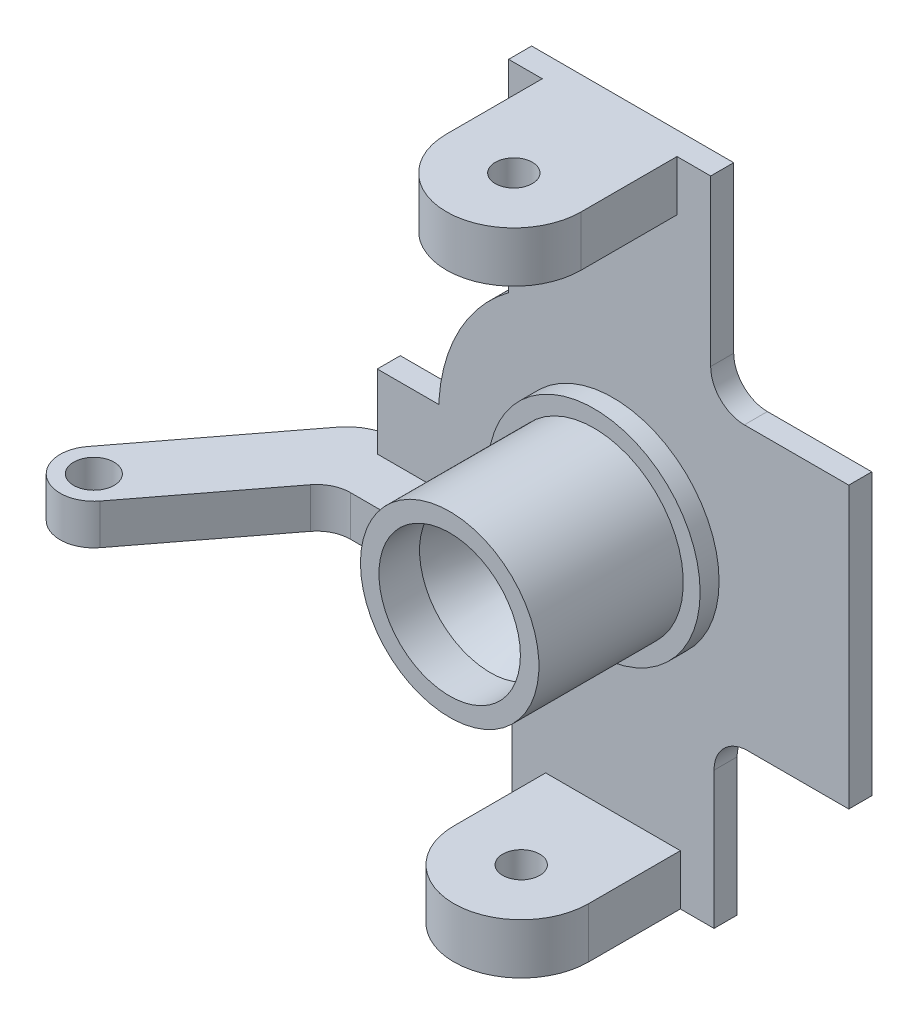
from build123d import *

# Parameters (mm, degrees)
EXTRUDE_1_DEPTH     = 6.84
EXTRUDE_2_DEPTH     = 12
SKETCH_3_R          = 26.5
EXTRUDE_3_DEPTH     = 48.5
SKETCH_4_R          = 31.5
EXTRUDE_4_DEPTH     = 5.63
SKETCH_5_R          = 21
CUT_EXTRUDE_1_DEPTH = 9.13
SKETCH_6_R          = 21
CUT_EXTRUDE_2_DEPTH = 2.92
SKETCH_7_R          = 16
SKETCH_9_R          = 21
SKETCH_8_R          = 16
SKETCH_10_R         = 17
CUT_EXTRUDE_3_DEPTH = 13.29
SKETCH_11_R         = 6
CUT_EXTRUDE_4_DEPTH = 42.92
EXTRUDE_5_DEPTH     = 15
SKETCH_13_R         = 5.5
CUT_EXTRUDE_5_DEPTH = 15
EXTRUDE_6_DEPTH     = 15
SKETCH_16_R         = 5.5
CUT_EXTRUDE_6_DEPTH = 15


with BuildPart() as part:
    # 스케치1 → 보스-돌출1 (new body)
    with BuildSketch(Plane.XY):
        with BuildLine():
            Line((-34.998826986, -181.181097978), (-34.998826986, -140.481097978))
            ThreePointArc((-34.998826986, -140.481097978), (-32.069894798, -133.410030166), (-24.998826986, -130.481097978))
            Line((-24.998826986, -130.481097978), (5.001173014, -130.481097978))
            Line((5.001173014, -130.481097978), (5.001173014, -47.181097978))
            Line((5.001173014, -47.181097978), (-25.998826986, -47.181097978))
            ThreePointArc((-25.998826986, -47.181097978), (-33.069894798, -44.25216579), (-35.998826986, -37.181097978))
            Line((-35.998826986, -37.181097978), (-35.998826986, 11.818902022))
            Line((-35.998826986, 11.818902022), (-95.998826986, 11.818902022))
            Line((-95.998826986, 11.818902022), (-95.998826986, -48.181097978))
            ThreePointArc((-95.998826986, -48.181097978), (-110.502915378, -64.929776001), (-116.68226469, -86.206581157))
            Line((-116.68226469, -86.206581157), (-116.68226469, -87.311097978))
            Line((-116.68226469, -87.311097978), (-134.998826986, -87.311097978))
            Line((-134.998826986, -87.311097978), (-134.998826986, -121.181097978))
            Line((-134.998826986, -121.181097978), (-104.998826986, -121.181097978))
            ThreePointArc((-104.998826986, -121.181097978), (-97.927759174, -124.110030166), (-94.998826986, -131.181097978))
            Line((-94.998826986, -131.181097978), (-94.998826986, -181.181097978))
            Line((-94.998826986, -181.181097978), (-34.998826986, -181.181097978))
        make_face()
    extrude(amount=EXTRUDE_1_DEPTH)

    # 스케치2 → 보스-돌출2 (add)
    with BuildSketch(Plane.XZ.offset(121.181097978)):
        with BuildLine():
            Line((-114.998826986, 0), (-114.998826986, 15.74))
            ThreePointArc((-114.998826986, 15.74), (-116.46329308, 19.275533906), (-119.998826986, 20.74))
            Line((-119.998826986, 20.74), (-129.093412943, 20.74))
            ThreePointArc((-129.093412943, 20.74), (-133.528440233, 21.777269783), (-137.043403564, 24.673893413))
            Line((-137.043403564, 24.673893413), (-164.048836366, 60.066106587))
            ThreePointArc((-164.048836366, 60.066106587), (-178.064933574, 61.949990621), (-179.948817607, 47.933893413))
            Line((-179.948817607, 47.933893413), (-147.876203482, 5.900840119))
            ThreePointArc((-147.876203482, 5.900840119), (-142.603758486, 1.555904675), (-135.951217551, 0))
            Line((-135.951217551, 0), (-114.998826986, 0))
        make_face()
    extrude(amount=-EXTRUDE_2_DEPTH)

    # 스케치3 → 보스-돌출3 (add)
    with BuildSketch(Plane.XY.offset(6.84)):
        with Locations(Location((-64.998826986, -91.181097978, 0), (0, 0, 180))):
            Circle(SKETCH_3_R)
    extrude(amount=EXTRUDE_3_DEPTH)

    # 스케치4 → 보스-돌출4 (add)
    with BuildSketch(Plane.XY.offset(6.84)):
        with Locations((-64.998826986, -91.181097978)):
            Circle(SKETCH_4_R)
    extrude(amount=EXTRUDE_4_DEPTH)

    # 스케치5 → 컷-돌출1 (cut)
    with BuildSketch(Plane.XY.offset(55.34)):
        with Locations((-64.998826986, -91.181097978)):
            Circle(SKETCH_5_R)
    extrude(amount=-CUT_EXTRUDE_1_DEPTH, mode=Mode.SUBTRACT)

    # 스케치6 → 컷-돌출2 (cut)
    with BuildSketch(Plane.XY.offset(46.21)):
        with Locations((-64.998826986, -91.181097978)):
            Circle(SKETCH_6_R)
    extrude(amount=-CUT_EXTRUDE_2_DEPTH, mode=Mode.SUBTRACT)

    # 스케치7 → section 0 of loft_1
    with BuildSketch(Plane.XY.offset(28.29), mode=Mode.PRIVATE) as loft_1_s0:
        with Locations((-64.998826986, -91.181097978)):
            Circle(SKETCH_7_R)
    # loft up to a face of the part (loft_1)
    loft([loft_1_s0.sketch, Face(Wire([part.edges().sort_by_distance((-79.374316211, -75.872756802, 43.29))[0]]))], mode=Mode.SUBTRACT)

    # 스케치9 → 컷-로프트3 section 0
    with BuildSketch(Plane(origin=(0, 0, 0), x_dir=(-1, 0, 0), z_dir=(0, 0, -1))):
        with Locations((64.998826986, -91.181097978)):
            Circle(SKETCH_9_R)
    # 스케치8 → 컷-로프트3 section 1
    with BuildSketch(Plane(origin=(0, 0, 15), x_dir=(-1, 0, 0), z_dir=(0, 0, -1))):
        with Locations((64.998826986, -91.181097978)):
            Circle(SKETCH_8_R)
    loft(mode=Mode.SUBTRACT)

    # 스케치10 → 컷-돌출3 (cut)
    with BuildSketch(Plane(origin=(0, 0, 15), x_dir=(-1, 0, 0), z_dir=(0, 0, -1))):
        with Locations((64.998826986, -91.181097978)):
            Circle(SKETCH_10_R)
    extrude(amount=-CUT_EXTRUDE_3_DEPTH, mode=Mode.SUBTRACT)

    # 스케치11 → 컷-돌출4 (cut)
    with BuildSketch(Plane(origin=(0, -109.181097978, 0), x_dir=(1, 0, 0), z_dir=(0, 1, 0))):
        with Locations(Location((-171.998826986, -54, 0), (0, 0, 180))):
            Circle(SKETCH_11_R)
    extrude(amount=-CUT_EXTRUDE_4_DEPTH, mode=Mode.SUBTRACT)

    # 스케치12 → 보스-돌출5 (add)
    with BuildSketch(Plane.XZ.offset(181.181097978)):
        with BuildLine():
            Line((-84.998826986, 6.84), (-84.998826986, 34.091376239))
            ThreePointArc((-84.998826986, 34.091376239), (-64.998826986, 54.091376239), (-44.998826986, 34.091376239))
            Line((-44.998826986, 34.091376239), (-44.998826986, 6.84))
            Line((-44.998826986, 6.84), (-84.998826986, 6.84))
        make_face()
    extrude(amount=-EXTRUDE_5_DEPTH)

    # 스케치13 → 컷-돌출5 (cut)
    with BuildSketch(Plane.XZ.offset(181.181097978)):
        with Locations(Location((-64.998826986, 34.091376239, 0), (0, 0, 270))):
            Circle(SKETCH_13_R)
    extrude(amount=-CUT_EXTRUDE_5_DEPTH, mode=Mode.SUBTRACT)

    # 스케치15 → 보스-돌출6 (add)
    with BuildSketch(Plane(origin=(0, 11.818902022, 0), x_dir=(1, 0, 0), z_dir=(0, 1, 0))):
        with BuildLine():
            Line((-85.998826986, -6.84), (-85.998826986, -35.286448376))
            ThreePointArc((-85.998826986, -35.286448376), (-65.998826986, -55.286448376), (-45.998826986, -35.286448376))
            Line((-45.998826986, -35.286448376), (-45.998826986, -6.84))
            Line((-45.998826986, -6.84), (-85.998826986, -6.84))
        make_face()
    extrude(amount=-EXTRUDE_6_DEPTH)

    # 스케치16 → 컷-돌출6 (cut)
    with BuildSketch(Plane(origin=(0, 11.818902022, 0), x_dir=(1, 0, 0), z_dir=(0, 1, 0))):
        with Locations(Location((-65.998826986, -35.286448376, 0), (0, 0, 270))):
            Circle(SKETCH_16_R)
    extrude(amount=-CUT_EXTRUDE_6_DEPTH, mode=Mode.SUBTRACT)


solid = part.part
